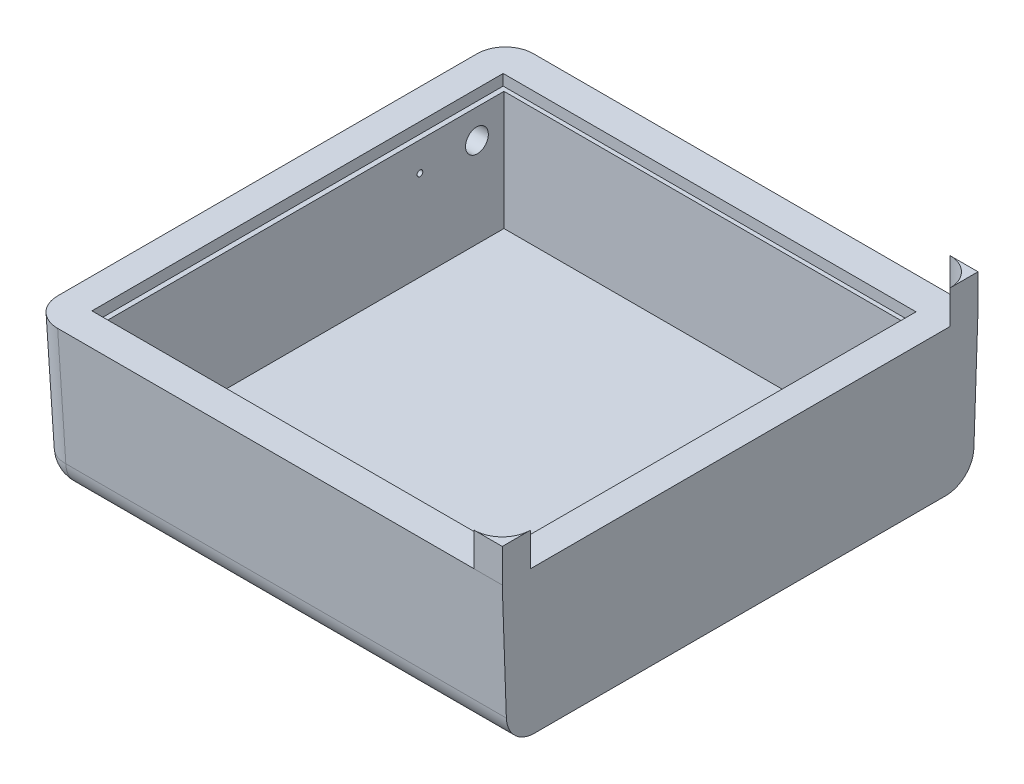
from build123d import *

# Parameters (mm, degrees)
SKETCH1_W               = 295
SKETCH1_H               = 292.1
BOSS_EXTRUDE1_DEPTH     = 88.69
BOSS_EXTRUDE1_DRAFT     = -2
SKETCH3_W               = 253.5
SKETCH3_H               = 252.5
CUT_EXTRUDE3_DEPTH      = 6.5
CUT_EXTRUDE3_DRAFT      = -2
SKETCH5_W               = 247
SKETCH5_H               = 247
CUT_EXTRUDE4_DEPTH      = 70.5
CUT_EXTRUDE4_DRAFT      = -2
CUT_EXTRUDE5_DEPTH      = 228.203831614
CUT_EXTRUDE5_DEPTH_BACK = 228.203831614
FILLET2_R               = 17.27
BOSS_EXTRUDE2_DEPTH     = 20.53
CUT_EXTRUDE6_REACH      = 337.359
SKETCH8_R               = 7
CUT_EXTRUDE7_DEPTH      = 5
CUT_EXTRUDE8_REACH      = 333.091
SKETCH9_R               = 1.75


with BuildPart() as part:
    # Sketch1 → Boss-Extrude1 (with draft: the straight prism first)
    with BuildSketch(Plane(origin=(0, 0, 0), x_dir=(1, 0, 0), z_dir=(0, 1, 0))):
        with Locations((2.25, 0)):
            Rectangle(SKETCH1_W, SKETCH1_H)
    extrude(amount=-BOSS_EXTRUDE1_DEPTH)
    # Boss-Extrude1: the draft: its side faces are tilted about the plane it starts from
    boss_extrude1_sides = [part.faces().sort_by_distance(p)[0] for p in [
        (2.25, -44.345, 146.05),
        (149.75, -44.345, 0),
        (2.25, -44.345, -146.05),
        (-145.25, -44.345, 0),
    ]]
    draft(boss_extrude1_sides, Plane(origin=(0, 0, 0), x_dir=(1, 0, 0), z_dir=(0, 1, 0)), BOSS_EXTRUDE1_DRAFT)


with BuildPart() as cut_extrude3_tool:
    # Sketch3 → Cut-Extrude3 (with draft: the straight prism first)
    with BuildSketch(Plane(origin=(0, 0, 0), x_dir=(1, 0, 0), z_dir=(0, 1, 0))):
        Rectangle(SKETCH3_W, SKETCH3_H)
    extrude(amount=-CUT_EXTRUDE3_DEPTH)
    # Cut-Extrude3: the draft: its side faces are tilted about the plane it starts from
    cut_extrude3_sides = [cut_extrude3_tool.faces().sort_by_distance(p)[0] for p in [
        (0, -3.25, 126.25),
        (126.75, -3.25, 0),
        (0, -3.25, -126.25),
        (-126.75, -3.25, 0),
    ]]
    draft(cut_extrude3_sides, Plane(origin=(0, 0, 0), x_dir=(1, 0, 0), z_dir=(0, 1, 0)), CUT_EXTRUDE3_DRAFT)


with BuildPart() as part_1:
    add(part.part)

    # Cut-Extrude3: cut by cut_extrude3_tool
    add(cut_extrude3_tool.part, mode=Mode.SUBTRACT)


with BuildPart() as cut_extrude4_tool:
    # Sketch5 → Cut-Extrude4 (with draft: the straight prism first)
    with BuildSketch(Plane(origin=(0, -6.5, 0), x_dir=(1, 0, 0), z_dir=(0, 1, 0))):
        Rectangle(SKETCH5_W, SKETCH5_H)
    extrude(amount=-CUT_EXTRUDE4_DEPTH)
    # Cut-Extrude4: the draft: its side faces are tilted about the plane it starts from
    cut_extrude4_sides = [cut_extrude4_tool.faces().sort_by_distance(p)[0] for p in [
        (0, -41.75, 123.5),
        (123.5, -41.75, 0),
        (0, -41.75, -123.5),
        (-123.5, -41.75, 0),
    ]]
    draft(cut_extrude4_sides, Plane(origin=(0, -6.5, 0), x_dir=(1, 0, 0), z_dir=(0, 1, 0)), CUT_EXTRUDE4_DRAFT)


with BuildPart() as part_2:
    add(part_1.part)

    # Cut-Extrude4: cut by cut_extrude4_tool
    add(cut_extrude4_tool.part, mode=Mode.SUBTRACT)

    # Sketch6 → Cut-Extrude5 (cut, two sides: drawn at the far end of the back side and taken through both)
    with BuildSketch(Plane.XY.offset(-CUT_EXTRUDE5_DEPTH_BACK)):
        Polygon((149.75, 0), (145, 0), (145, -88.69), (146.652876954, -88.69), align=None)
    extrude(amount=CUT_EXTRUDE5_DEPTH + CUT_EXTRUDE5_DEPTH_BACK, mode=Mode.SUBTRACT)

    # Fillet2
    fillet2_edges = [part_2.edges().sort_by_distance(p)[0] for p in [
        (1.423561523, -88.69, -142.952876954),
        (-143.701438477, -44.345, -144.501438477),
        (-142.152876954, -88.69, 0),
        (-143.701438477, -44.345, 144.501438477),
        (1.423561523, -88.69, 142.952876954),
    ]]
    fillet(fillet2_edges, radius=FILLET2_R)

    # Sketch7 → Boss-Extrude2 (add)
    with BuildSketch(Plane(origin=(0, 0, 0), x_dir=(1, 0, 0), z_dir=(0, 1, 0))):
        with BuildLine():
            Line((145, 128.78), (145, 146.05))
            Line((145, 146.05), (127.73, 146.05))
            ThreePointArc((127.73, 146.05), (139.941734111, 140.991734111), (145, 128.78))
        make_face()
        with BuildLine():
            Line((145, -146.05), (127.73, -146.05))
            ThreePointArc((127.73, -146.05), (139.941734111, -140.991734111), (145, -128.78))
            Line((145, -128.78), (145, -146.05))
        make_face()
    extrude(amount=BOSS_EXTRUDE2_DEPTH)

    # Sketch8 → Cut-Extrude6 (cut, up to next)
    with BuildSketch(Plane(origin=(-145.07308915, -5.066063906, 0), x_dir=(0, 0, 1), z_dir=(-0.9993908270190958, -0.03489949670250105, 0)), mode=Mode.PRIVATE) as cut_extrude6_sk1:
        with Locations((-106.3, -19.400848104)):
            Circle(SKETCH8_R)
    cut_extrude6_tool1 = extrude(cut_extrude6_sk1.sketch, amount=-CUT_EXTRUDE6_REACH, mode=Mode.PRIVATE) & part_2.part
    add(cut_extrude6_tool1.solids().sort_by_distance((-144.396009, -24.455094, -106.3))[0], mode=Mode.SUBTRACT)

    # Sketch8<3> → Cut-Extrude7 (cut)
    with BuildSketch(Plane(origin=(-145.07308915, -5.066063906, 0), x_dir=(0, 0, 1), z_dir=(-0.9993908270190958, -0.03489949670250105, 0))):
        with BuildLine():
            ThreePointArc((-77, -21.250848104), (-76.707106781, -21.957954885), (-76, -22.250848104))
            Line((-76, -22.250848104), (-66.6, -22.250848104))
            ThreePointArc((-66.6, -22.250848104), (-65.892893219, -21.957954885), (-65.6, -21.250848104))
            Line((-65.6, -21.250848104), (-65.6, -17.550848104))
            ThreePointArc((-65.6, -17.550848104), (-65.892893219, -16.843741323), (-66.6, -16.550848104))
            Line((-66.6, -16.550848104), (-76, -16.550848104))
            ThreePointArc((-76, -16.550848104), (-76.707106781, -16.843741323), (-77, -17.550848104))
            Line((-77, -17.550848104), (-77, -21.250848104))
        make_face()
    extrude(amount=-CUT_EXTRUDE7_DEPTH, mode=Mode.SUBTRACT)

    # Sketch9 → Cut-Extrude8 (cut, up to next)
    with BuildSketch(Plane(origin=(-140.076135015, -4.891566422, 0), x_dir=(0, 0, 1), z_dir=(-0.9993908270190958, -0.03489949670250113, 0)), mode=Mode.PRIVATE) as cut_extrude8_sk1:
        with Locations((-71.3, -19.400848104)):
            Circle(SKETCH9_R)
    cut_extrude8_tool1 = extrude(cut_extrude8_sk1.sketch, amount=-CUT_EXTRUDE8_REACH, mode=Mode.PRIVATE) & part_2.part
    add(cut_extrude8_tool1.solids().sort_by_distance((-139.399055, -24.280596, -71.3))[0], mode=Mode.SUBTRACT)


solid = part_2.part
